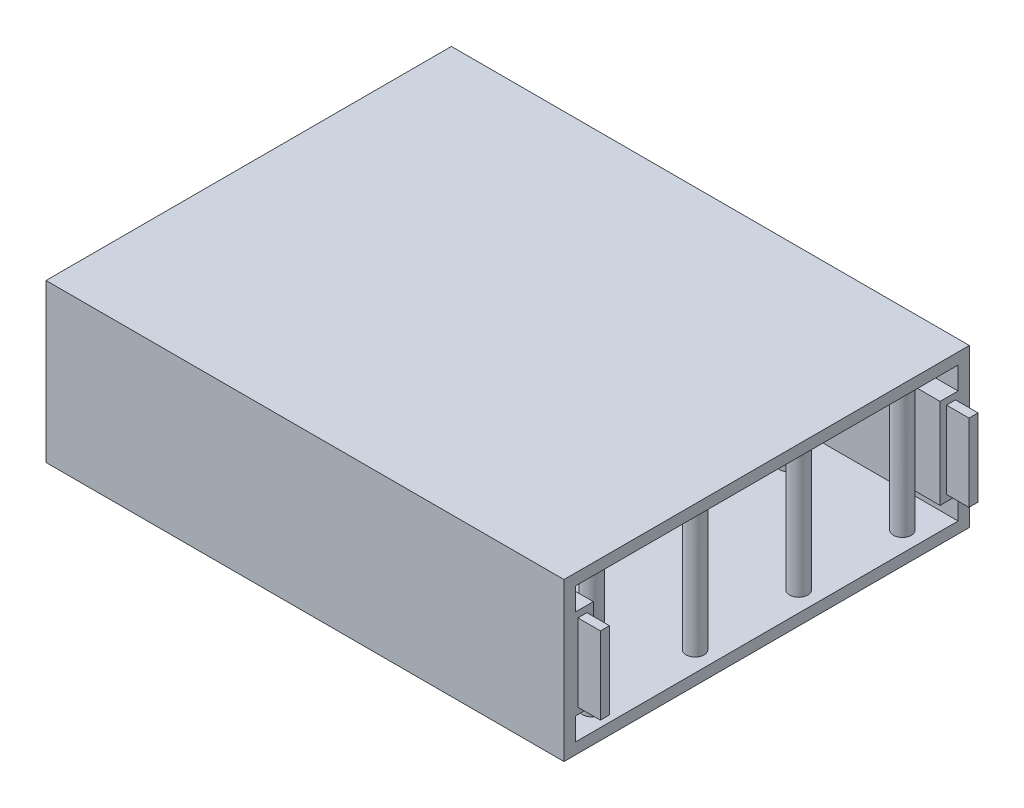
from build123d import *

# Parameters (mm, degrees)
SKETCH_1_W          = 115
SKETCH_1_H          = 90
EXTRUDE_1_DEPTH     = 35
SKETCH_2_W          = 85
SKETCH_2_H          = 30
CUT_EXTRUDE_1_DEPTH = 129.35497653
SKETCH_3_W          = 4
SKETCH_3_H          = 20
EXTRUDE_2_DEPTH     = 10
SKETCH_4_W          = 2
SKETCH_4_H          = 17.171572876
EXTRUDE_3_DEPTH     = 5
SKETCH_5_R          = 2
SKETCH_5_R_2        = 10
EXTRUDE_4_DEPTH     = 32


with BuildPart() as part:
    # Эскиз1 → Бобышка-Вытянуть1 (new body)
    with BuildSketch(Plane(origin=(0, 0, 0), x_dir=(1, 0, 0), z_dir=(0, 1, 0))):
        Rectangle(SKETCH_1_W, SKETCH_1_H)
    extrude(amount=EXTRUDE_1_DEPTH)

    # Эскиз2 → Вырез-Вытянуть1 (cut, through all)
    with BuildSketch(Plane(origin=(57.5, 0, 0), x_dir=(0, 0, -1), z_dir=(1, 0, 0))):
        with Locations((0, 17.5)):
            Rectangle(SKETCH_2_W, SKETCH_2_H)
    extrude(amount=-CUT_EXTRUDE_1_DEPTH, mode=Mode.SUBTRACT)

    # Эскиз3 → Бобышка-Вытянуть2 (add)
    with BuildSketch(Plane(origin=(57.5, 0, 0), x_dir=(0, 0, -1), z_dir=(1, 0, 0))):
        with Locations((40.5, 17.5)):
            Rectangle(SKETCH_3_W, SKETCH_3_H)
        with Locations((-40.5, 17.5)):
            Rectangle(SKETCH_3_W, SKETCH_3_H)
    extrude(amount=-EXTRUDE_2_DEPTH)

    # Эскиз4 → Бобышка-Вытянуть3 (add)
    with BuildSketch(Plane(origin=(57.5, 0, 0), x_dir=(0, 0, -1), z_dir=(1, 0, 0))):
        with Locations((40.914213562, 17.5)):
            Rectangle(SKETCH_4_W, SKETCH_4_H)
        with Locations((-40.914213562, 17.5)):
            Rectangle(SKETCH_4_W, SKETCH_4_H)
    extrude(amount=EXTRUDE_3_DEPTH)

    # Эскиз5 → Бобышка-Вытянуть4 (add)
    with BuildSketch(Plane(origin=(0, 2.5, 0), x_dir=(1, 0, 0), z_dir=(0, 1, 0))):
        with Locations(Location((-52.113626613, 34.564029455, 0), (0, 0, 90))):
            Circle(SKETCH_5_R)
        with Locations(Location((-52.113626613, 11.564029455, 0), (0, 0, 90))):
            Circle(SKETCH_5_R)
        with Locations(Location((-52.113626613, -11.435970545, 0), (0, 0, 90))):
            Circle(SKETCH_5_R)
        with Locations(Location((-52.113626613, -34.435970545, 0), (0, 0, 90))):
            Circle(SKETCH_5_R)
        with Locations(Location((53.054505716, 34.564029455, 0), (0, 0, 90))):
            Circle(SKETCH_5_R)
        with Locations(Location((53.054505716, 11.564029455, 0), (0, 0, 90))):
            Circle(SKETCH_5_R)
        with Locations(Location((53.054505716, -11.435970545, 0), (0, 0, 90))):
            Circle(SKETCH_5_R)
        with Locations(Location((53.054505716, -34.435970545, 0), (0, 0, 90))):
            Circle(SKETCH_5_R)
        with Locations(Location((-12.113626613, 34.564029455, 0), (0, 0, 90))):
            Circle(SKETCH_5_R)
        with Locations(Location((27.886373387, 34.564029455, 0), (0, 0, 90))):
            Circle(SKETCH_5_R)
        with Locations(Location((-12.113626613, -34.435970545, 0), (0, 0, 90))):
            Circle(SKETCH_5_R)
        with Locations(Location((27.886373387, -34.435970545, 0), (0, 0, 90))):
            Circle(SKETCH_5_R)
        with Locations(Location((0, 0, 0), (0, 0, 90))):
            Circle(SKETCH_5_R_2)
    extrude(amount=EXTRUDE_4_DEPTH)


solid = part.part
